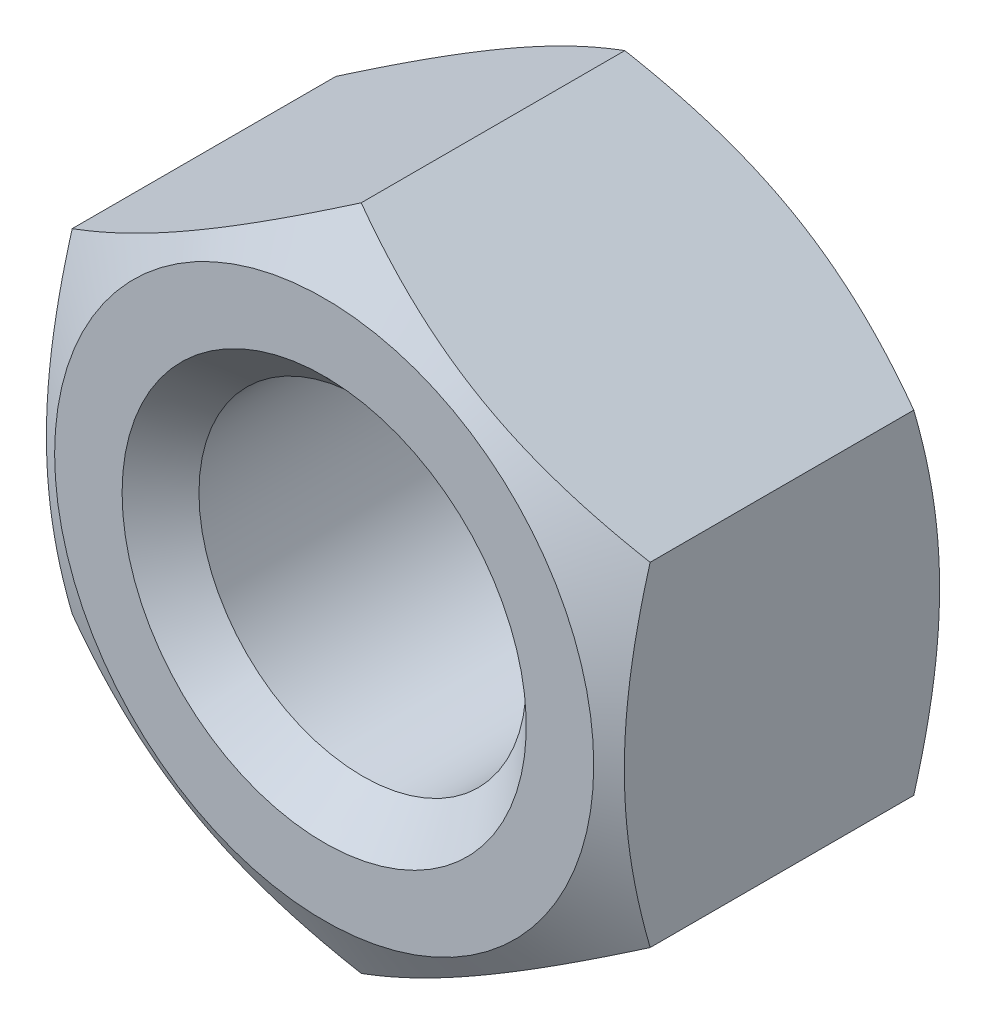
from build123d import *

# Parameters (mm, degrees)
SKETCH2_OUTSIDE_W  = 43.152
SKETCH2_OUTSIDE_H  = 43.152
CUT_EXTRUDE2_DEPTH = 25.4


with BuildPart() as part:
    # Sketch1 → Revolve1 (revolve)
    with BuildSketch(Plane(origin=(0, 0, 0), x_dir=(0, 0, -1), z_dir=(1, 0, 0)), mode=Mode.PRIVATE) as revolve1_sk:
        Polygon((-1.584325, 6.746875), (-12.334875, 6.746875), (-13.9192, 8.3312), (-13.9192, 11.1125), (-11.169569343, 15.875), (-2.749630657, 15.875), (0, 11.1125), (0, 8.3312), align=None)
    revolve(revolve1_sk.sketch.rotate(Axis((0, 0, -10.380814409), (0, 0, 1)), 90), axis=Axis((0, 0, -10.380814409), (0, 0, 1)))

    # Sketch2 outside → Cut-Extrude2 (cut)
    with BuildSketch(Plane.XY):
        Rectangle(SKETCH2_OUTSIDE_W, SKETCH2_OUTSIDE_H)
        Polygon((0, 13.755485633), (-11.9126, 6.877742817), (-11.9126, -6.877742817), (0, -13.755485633), (11.9126, -6.877742817), (11.9126, 6.877742817), align=None, mode=Mode.SUBTRACT)
    extrude(amount=CUT_EXTRUDE2_DEPTH, mode=Mode.SUBTRACT)


solid = part.part
